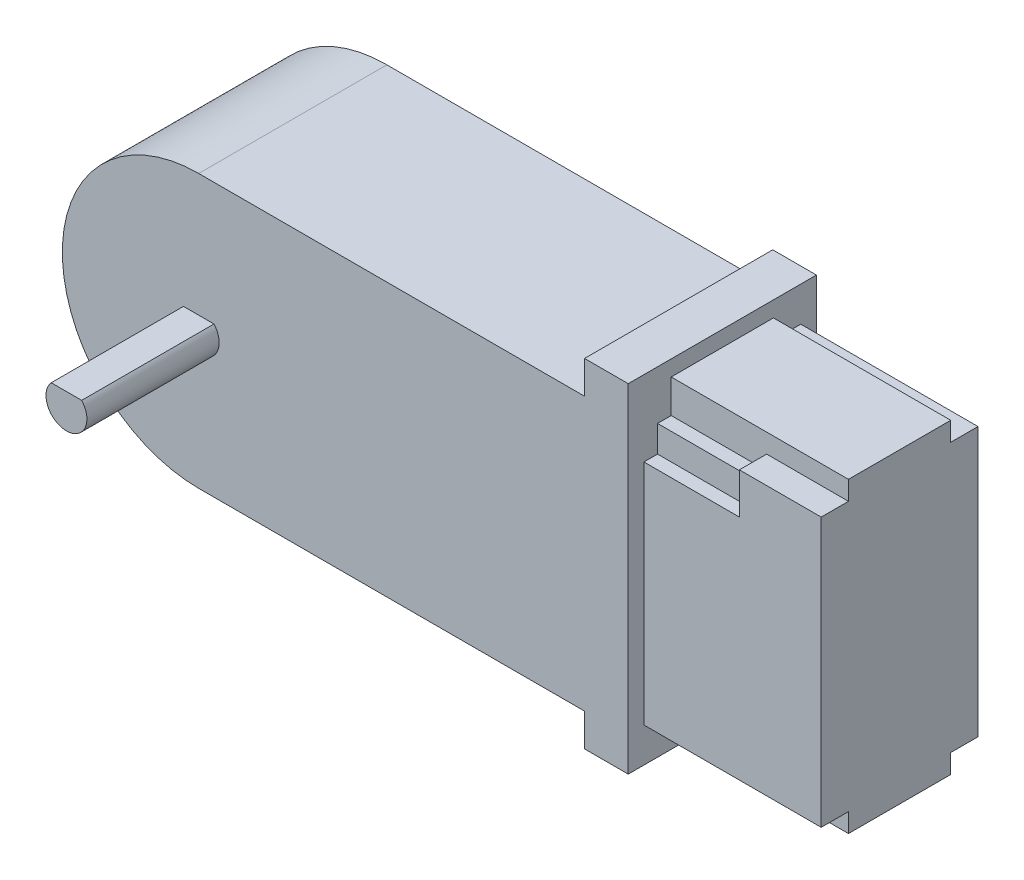
from build123d import *

# Parameters (mm, degrees)
SKETCH1_R           = 10
SKETCH1_W           = 31.5
SKETCH1_H           = 20
SKETCH1_W_2         = 3.204542896
SKETCH1_H_2         = 24.8
BOSS_EXTRUDE1_DEPTH = 6.9
BOSS_EXTRUDE2_DEPTH = 5.75
BOSS_EXTRUDE3_DEPTH = 9.7
SKETCH3_W           = 13
SKETCH3_H           = 1.999999936
SKETCH3_H_2         = 2.000000064
CUT_EXTRUDE1_DEPTH  = 1.397
SKETCH4_W           = 7.0000114
SKETCH4_H           = 1.016
CUT_EXTRUDE2_DEPTH  = 2.000000064
SKETCH4_3_W         = 7.0000114
SKETCH4_3_H         = 2.032
CUT_EXTRUDE3_DEPTH  = 0.95
SKETCH6_W           = 7
SKETCH6_H           = 1.947
CUT_EXTRUDE4_DEPTH  = 1
SKETCH6_3_W         = 7
SKETCH6_3_H         = 1.053
CUT_EXTRUDE5_DEPTH  = 1.999999936
BOSS_EXTRUDE4_START = -3.75
BOSS_EXTRUDE4_DEPTH = 7.5


with BuildPart() as part:
    # Sketch1 → Boss-Extrude1 (new, symmetric)
    with BuildSketch(Plane.XY):
        Circle(SKETCH1_R)
        with Locations((15.75, 0)):
            Rectangle(SKETCH1_W, SKETCH1_H)
        with Locations((29.897728552, 0)):
            Rectangle(SKETCH1_W_2, SKETCH1_H_2)
    extrude(amount=BOSS_EXTRUDE1_DEPTH, both=True)

    # Sketch2 → Boss-Extrude3 (add)
    with BuildSketch(Plane.XY.offset(6.9)):
        with BuildLine():
            Line((1.118033989, 1), (-1.118033989, 1))
            ThreePointArc((-1.118033989, 1), (-0.535233135, -1.401258538), (1.5, 0))
            ThreePointArc((1.5, 0), (1.401258538, 0.535233135), (1.118033989, 1))
        make_face()
    extrude(amount=BOSS_EXTRUDE3_DEPTH)

    # Sketch8 → Boss-Extrude4 (add)
    with BuildSketch(Plane.XY.offset(BOSS_EXTRUDE4_START)):
        Polygon((26.795457104, 10.4), (28.295457104, 10.4), (28.295457104, 11.9), align=None)
        Polygon((26.795457104, -10.4), (28.295457104, -10.4), (28.295457104, -11.9), align=None)
    extrude(amount=BOSS_EXTRUDE4_DEPTH)


with BuildPart() as body_2:
    # Sketch1<3> → Boss-Extrude2 (new, symmetric)
    with BuildSketch(Plane.XY):
        Polygon((31.5, 11.25), (31.5, 10), (31.5, 0), (44.5, 0), (44.5, 11.25), align=None)
        Polygon((31.5, 0), (31.5, -10), (31.5, -11.25), (44.5, -11.25), (44.5, 0), align=None)
    extrude(amount=BOSS_EXTRUDE2_DEPTH, both=True)

    # Sketch3 → Cut-Extrude1 (cut)
    with BuildSketch(Plane.XZ.offset(11.25)):
        with Locations((38, 4.750000032)):
            Rectangle(SKETCH3_W, SKETCH3_H)
        with Locations((38, -4.749999968)):
            Rectangle(SKETCH3_W, SKETCH3_H_2)
    cut_extrude1 = extrude(amount=-CUT_EXTRUDE1_DEPTH, mode=Mode.SUBTRACT)

    # Mirror1: Cut-Extrude1 across plane
    add(cut_extrude1.mirror(Plane.ZX), mode=Mode.SUBTRACT)

    # Sketch4 → Cut-Extrude2 (cut)
    with BuildSketch(Plane(origin=(0, 0, -5.75), x_dir=(-1, 0, 0), z_dir=(0, 0, -1))):
        with Locations((-35.0000057, -9.345)):
            Rectangle(SKETCH4_W, SKETCH4_H)
    extrude(amount=-CUT_EXTRUDE2_DEPTH, mode=Mode.SUBTRACT)

    # Sketch4<3> → Cut-Extrude3 (cut)
    with BuildSketch(Plane(origin=(0, 0, -5.75), x_dir=(-1, 0, 0), z_dir=(0, 0, -1))):
        with Locations((-35.0000057, -7.821)):
            Rectangle(SKETCH4_3_W, SKETCH4_3_H)
    extrude(amount=-CUT_EXTRUDE3_DEPTH, mode=Mode.SUBTRACT)

    # Sketch6 → Cut-Extrude4 (cut)
    with BuildSketch(Plane.XY.offset(5.75)):
        with Locations((35, 7.8265)):
            Rectangle(SKETCH6_W, SKETCH6_H)
    extrude(amount=-CUT_EXTRUDE4_DEPTH, mode=Mode.SUBTRACT)

    # Sketch6<3> → Cut-Extrude5 (cut)
    with BuildSketch(Plane.XY.offset(5.75)):
        with Locations((35, 9.3265)):
            Rectangle(SKETCH6_3_W, SKETCH6_3_H)
    extrude(amount=-CUT_EXTRUDE5_DEPTH, mode=Mode.SUBTRACT)


solid = Compound([part.part, body_2.part])
